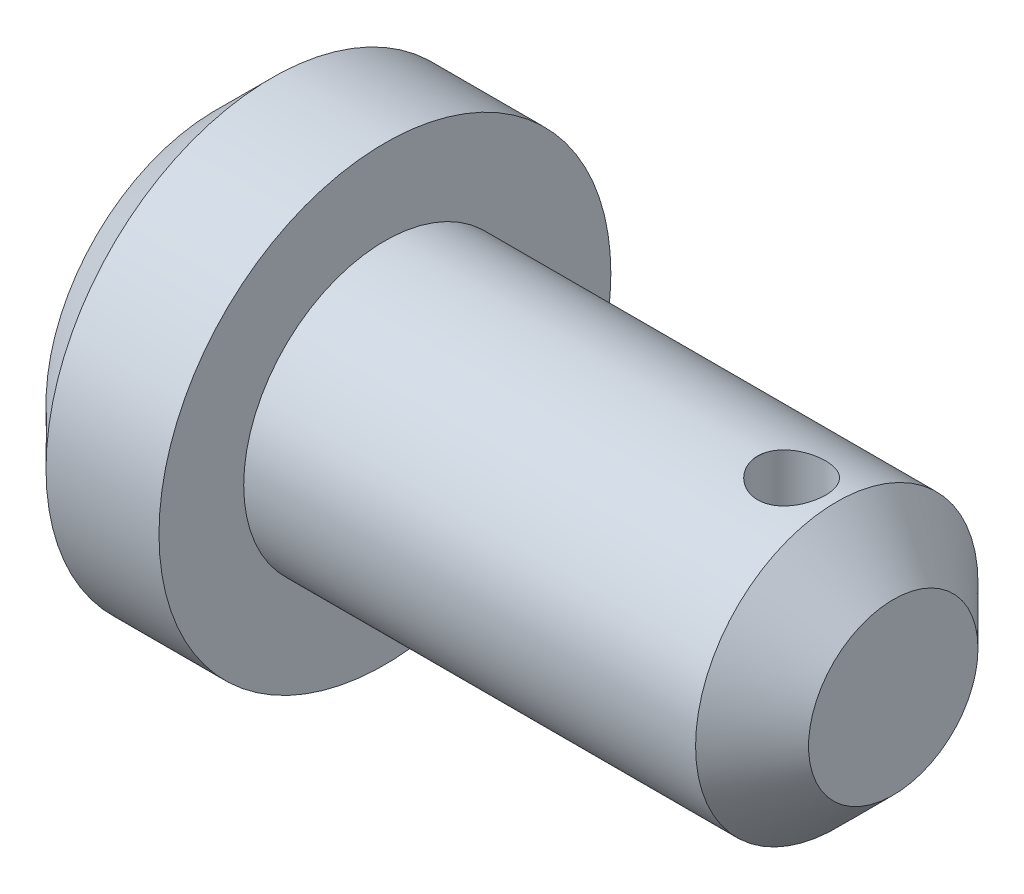
from build123d import *

# Parameters (mm, degrees)
SKETCH2_R                            = 40
BOSS_EXTRUDE1_DEPTH                  = 60
SKETCH3_R                            = 40
SKETCH3_R_2                          = 25
CUT_EXTRUDE1_DEPTH                   = 90
CHAMFER1_SIZE                        = 10
F_12_0_12_DIAMETER_HOLE1_D           = 12
F_12_0_12_DIAMETER_HOLE1_CSINK_D     = 12.05
F_12_0_12_DIAMETER_HOLE1_CSINK_ANGLE = 90


with BuildPart() as part:
    # Sketch2 → Boss-Extrude1 (new, symmetric)
    with BuildSketch(Plane.YZ):
        with Locations(Location((0, 0, 0), (0, 0, 90))):
            Circle(SKETCH2_R)
    extrude(amount=BOSS_EXTRUDE1_DEPTH, both=True)

    # Sketch3 → Cut-Extrude1 (cut)
    with BuildSketch(Plane.YZ.offset(60)):
        with Locations(Location((0, 0, 0), (0, 0, 90))):
            Circle(SKETCH3_R)
        with Locations(Location((0, 0, 0), (0, 0, 270))):
            Circle(SKETCH3_R_2, mode=Mode.SUBTRACT)
    extrude(amount=-CUT_EXTRUDE1_DEPTH, mode=Mode.SUBTRACT)

    # Chamfer1
    chamfer1_edges = [part.edges().sort_by_distance(p)[0] for p in [
        (-60, 0, -40),
        (60, 0, 25),
    ]]
    chamfer(chamfer1_edges, length=CHAMFER1_SIZE)

    # Ø12.0 (12) Diameter Hole1 (through all)
    with Locations(Plane(origin=(0, 25, 0), x_dir=(1, 0, 0), z_dir=(0, 1, 0))):
        with Locations((42, 0)):
            CounterSinkHole(F_12_0_12_DIAMETER_HOLE1_D / 2, F_12_0_12_DIAMETER_HOLE1_CSINK_D / 2, counter_sink_angle=F_12_0_12_DIAMETER_HOLE1_CSINK_ANGLE)


solid = part.part
